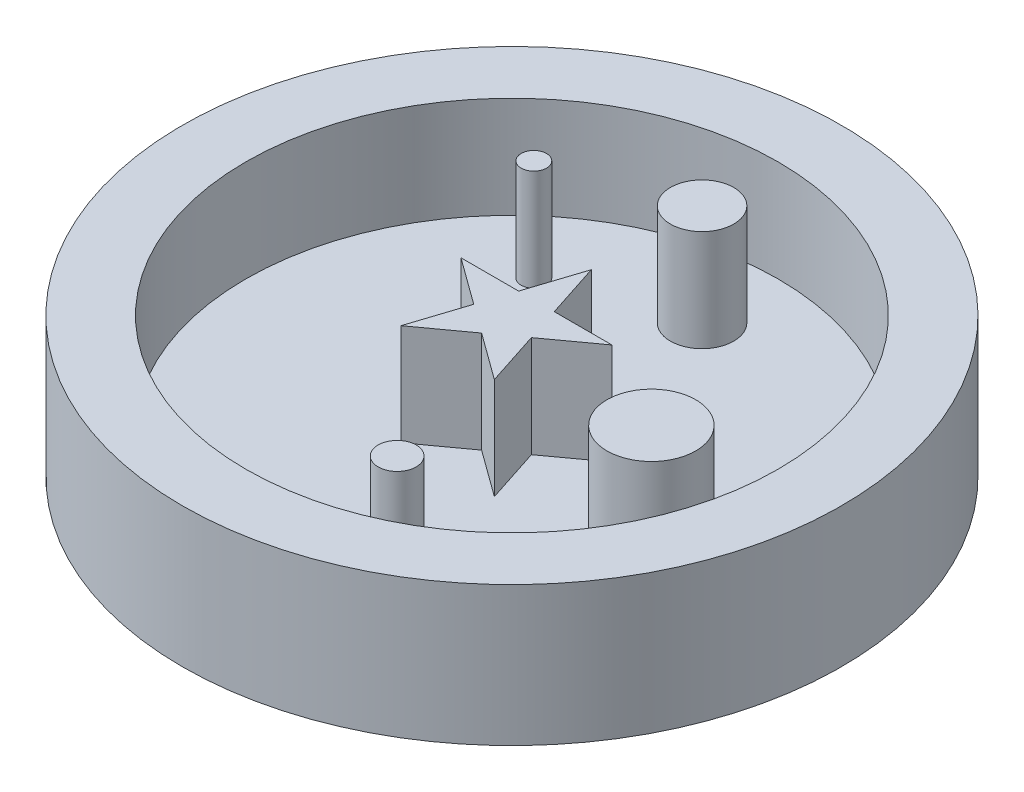
from build123d import *

# Parameters (mm, degrees)
SKETCH1_R           = 26
BOSS_EXTRUDE1_DEPTH = 11
SKETCH2_R           = 21
CUT_EXTRUDE1_DEPTH  = 8
BOSS_EXTRUDE2_DEPTH = 8
SKETCH5_R           = 1
BOSS_EXTRUDE3_DEPTH = 8
SKETCH6_R           = 2.5
BOSS_EXTRUDE4_DEPTH = 8
SKETCH7_R           = 3.5
BOSS_EXTRUDE5_DEPTH = 8
SKETCH11_R          = 1.5
BOSS_EXTRUDE6_DEPTH = 8


with BuildPart() as part:
    # Sketch1 → Boss-Extrude1 (new body)
    with BuildSketch(Plane(origin=(0, 0, 0), x_dir=(1, 0, 0), z_dir=(0, 1, 0))):
        with Locations(Location((0, 0, 0), (0, 0, 270))):
            Circle(SKETCH1_R)
    extrude(amount=BOSS_EXTRUDE1_DEPTH)

    # Sketch2 → Cut-Extrude1 (cut)
    with BuildSketch(Plane(origin=(0, 11, 0), x_dir=(1, 0, 0), z_dir=(0, 1, 0))):
        with Locations(Location((0, 0, 0), (0, 0, 270))):
            Circle(SKETCH2_R)
    extrude(amount=-CUT_EXTRUDE1_DEPTH, mode=Mode.SUBTRACT)

    # Sketch3 → Boss-Extrude2 (add)
    with BuildSketch(Plane(origin=(0, 3, 0), x_dir=(1, 0, 0), z_dir=(0, 1, 0))):
        Polygon((0, 6.260990337), (-1.405679911, 1.934752416), (-5.954555658, 1.934752416), (-2.274437874, -0.739009663), (-3.680117785, -5.065247584), (0, -2.391485505), (3.680117785, -5.065247584), (2.274437874, -0.739009663), (5.954555658, 1.934752416), (1.405679911, 1.934752416), align=None)
    extrude(amount=BOSS_EXTRUDE2_DEPTH)

    # Sketch5 → Boss-Extrude3 (add)
    with BuildSketch(Plane(origin=(0, 3, 0), x_dir=(1, 0, 0), z_dir=(0, 1, 0))):
        with Locations(Location((-9.706719743, 11.435890513, 0), (0, 0, 270))):
            Circle(SKETCH5_R)
    extrude(amount=BOSS_EXTRUDE3_DEPTH)

    # Sketch6 → Boss-Extrude4 (add)
    with BuildSketch(Plane(origin=(0, 3, 0), x_dir=(1, 0, 0), z_dir=(0, 1, 0))):
        with Locations(Location((0, 15, 0), (0, 0, 270))):
            Circle(SKETCH6_R)
    extrude(amount=BOSS_EXTRUDE4_DEPTH)

    # Sketch7 → Boss-Extrude5 (add)
    with BuildSketch(Plane(origin=(0, 3, 0), x_dir=(1, 0, 0), z_dir=(0, 1, 0))):
        with Locations(Location((13, -2, 0), (0, 0, 270))):
            Circle(SKETCH7_R)
    extrude(amount=BOSS_EXTRUDE5_DEPTH)

    # Sketch11 → Boss-Extrude6 (add)
    with BuildSketch(Plane(origin=(0, 3, 0), x_dir=(1, 0, 0), z_dir=(0, 1, 0))):
        with Locations(Location((5.064482164, -14.119172086, 0), (0, 0, 270))):
            Circle(SKETCH11_R)
    extrude(amount=BOSS_EXTRUDE6_DEPTH)


solid = part.part
